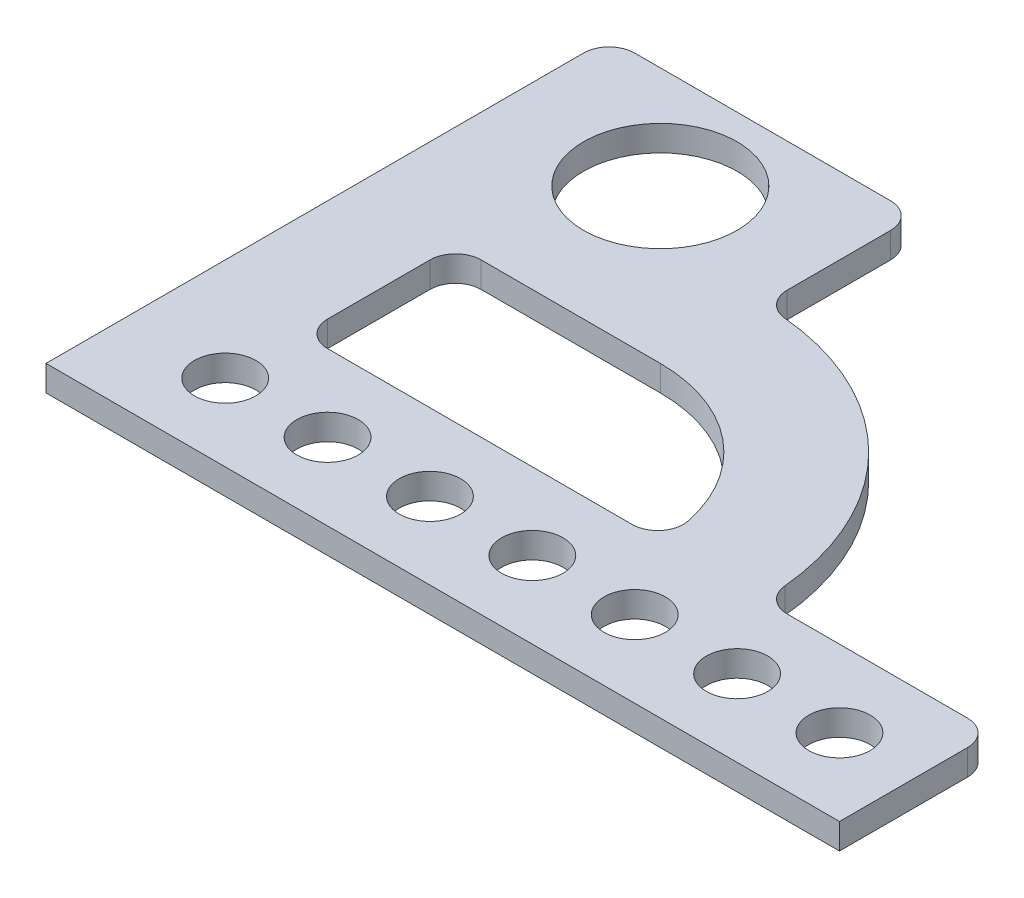
from build123d import *

# Parameters (mm, degrees)
SKETCH1_R           = 15
SKETCH1_R_2         = 6
BOSS_EXTRUDE1_DEPTH = 5


with BuildPart() as part:
    # Sketch1 → Boss-Extrude1 (new body)
    with BuildSketch(Plane(origin=(0, 0, 0), x_dir=(1, 0, 0), z_dir=(0, 1, 0))):
        with BuildLine():
            Line((114.772255751, 30), (150, 30))
            ThreePointArc((150, 30), (153.535533906, 28.535533906), (155, 25))
            Line((155, 25), (155, 0))
            Line((155, 0), (0, 0))
            Line((0, 0), (0, 105))
            ThreePointArc((0, 105), (1.464466094, 108.535533906), (5, 110))
            Line((5, 110), (55, 110))
            ThreePointArc((55, 110), (58.535533906, 108.535533906), (60, 105))
            Line((60, 105), (60, 84.772255751))
            ThreePointArc((60, 84.772255751), (61.307255271, 81.401256438), (64.545454545, 79.792959773))
            ThreePointArc((64.545454545, 79.792959773), (95.355339059, 65.355339059), (109.792959773, 34.545454545))
            ThreePointArc((109.792959773, 34.545454545), (111.401256438, 31.307255271), (114.772255751, 30))
        make_face()
        with Locations(Location((30, 90, 0), (0, 0, 270))):
            Circle(SKETCH1_R, mode=Mode.SUBTRACT)
        with Locations(Location((20, 15, 0), (0, 0, 270))):
            Circle(SKETCH1_R_2, mode=Mode.SUBTRACT)
        with Locations(Location((40, 15, 0), (0, 0, 270))):
            Circle(SKETCH1_R_2, mode=Mode.SUBTRACT)
        with Locations(Location((60, 15, 0), (0, 0, 270))):
            Circle(SKETCH1_R_2, mode=Mode.SUBTRACT)
        with Locations(Location((80, 15, 0), (0, 0, 270))):
            Circle(SKETCH1_R_2, mode=Mode.SUBTRACT)
        with Locations(Location((100, 15, 0), (0, 0, 270))):
            Circle(SKETCH1_R_2, mode=Mode.SUBTRACT)
        with Locations(Location((120, 15, 0), (0, 0, 270))):
            Circle(SKETCH1_R_2, mode=Mode.SUBTRACT)
        with Locations(Location((140, 15, 0), (0, 0, 270))):
            Circle(SKETCH1_R_2, mode=Mode.SUBTRACT)
        with BuildLine():
            Line((20, 55), (20, 35))
            ThreePointArc((20, 35), (21.464466094, 31.464466094), (25, 30))
            Line((25, 30), (84.494897428, 30))
            ThreePointArc((84.494897428, 30), (88.367880774, 31.83772234), (89.393876913, 36))
            ThreePointArc((89.393876913, 36), (78.973665961, 53.237900077), (60, 60))
            Line((60, 60), (25, 60))
            ThreePointArc((25, 60), (21.464466094, 58.535533906), (20, 55))
        make_face(mode=Mode.SUBTRACT)
    extrude(amount=BOSS_EXTRUDE1_DEPTH)


solid = part.part
